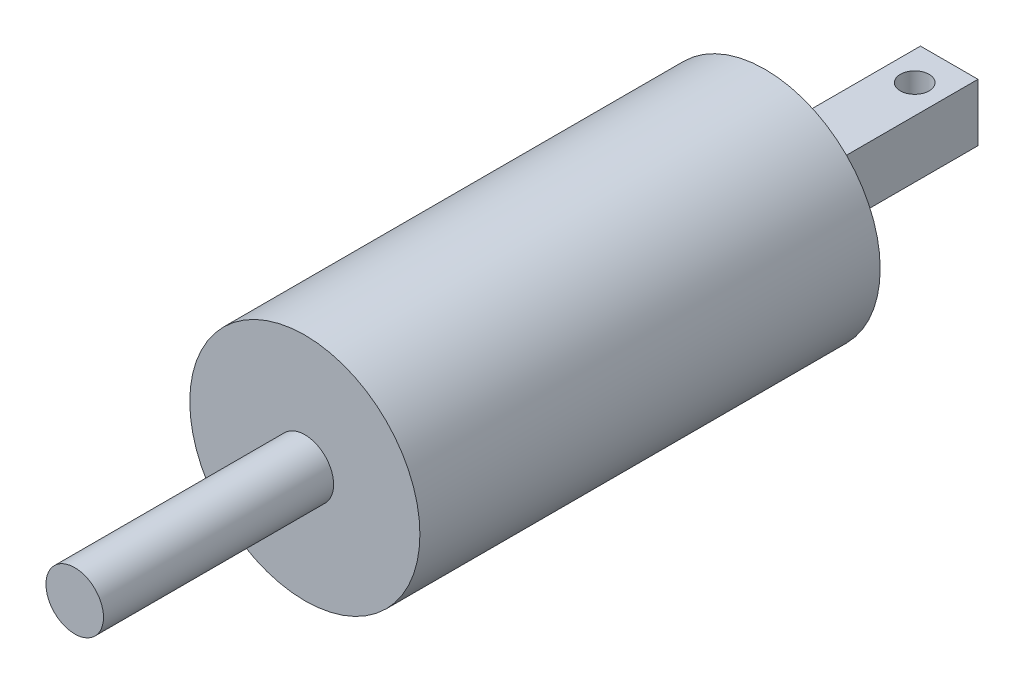
from build123d import *

# Parameters (mm, degrees)
SKETCH1_R           = 12.7
BOSS_EXTRUDE1_DEPTH = 25.4
SKETCH2_R           = 3.175
BOSS_EXTRUDE2_DEPTH = 25.4
SKETCH3_W           = 6.35
SKETCH3_H           = 6.35
BOSS_EXTRUDE3_DEPTH = 20.32
SKETCH4_R           = 1.5875
CUT_EXTRUDE1_DEPTH  = 55.716959208


with BuildPart() as part:
    # Sketch1 → Boss-Extrude1 (new, symmetric)
    with BuildSketch(Plane.XY):
        Circle(SKETCH1_R)
    extrude(amount=BOSS_EXTRUDE1_DEPTH, both=True)

    # Sketch2 → Boss-Extrude2 (add)
    with BuildSketch(Plane.XY.offset(25.4)):
        Circle(SKETCH2_R)
    extrude(amount=BOSS_EXTRUDE2_DEPTH)

    # Sketch3 → Boss-Extrude3 (add)
    with BuildSketch(Plane(origin=(0, 0, -25.4), x_dir=(-1, 0, 0), z_dir=(0, 0, -1))):
        Rectangle(SKETCH3_W, SKETCH3_H)
    extrude(amount=BOSS_EXTRUDE3_DEPTH)

    # Sketch4 → Cut-Extrude1 (cut, through all)
    with BuildSketch(Plane(origin=(0, 3.175, 0), x_dir=(1, 0, 0), z_dir=(0, 1, 0))):
        with Locations(Location((0, 41.91, 0), (0, 0, 270))):
            Circle(SKETCH4_R)
    extrude(amount=-CUT_EXTRUDE1_DEPTH, mode=Mode.SUBTRACT)


solid = part.part
